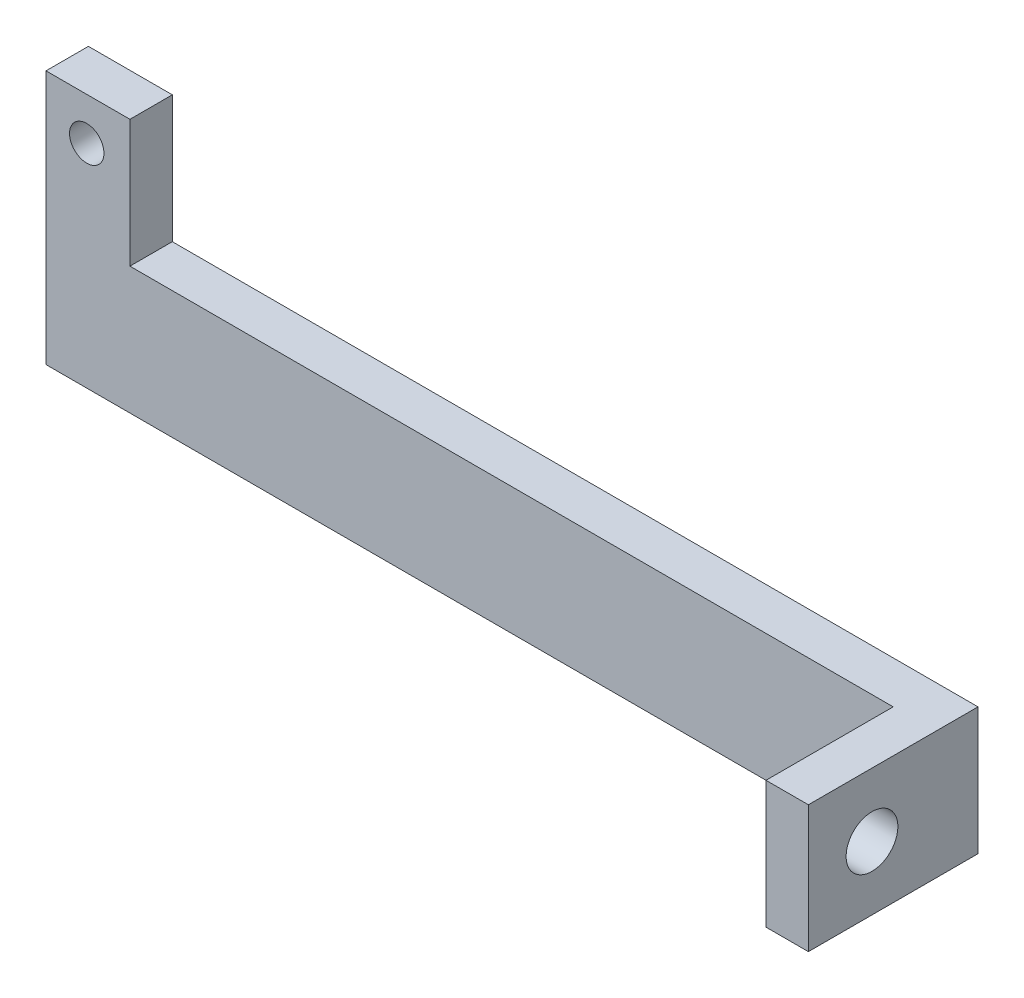
from build123d import *

# Parameters (mm, degrees)
SKETCH2_W           = 48.26
SKETCH2_H           = 7.62
BOSS_EXTRUDE1_DEPTH = 2.54
SKETCH3_W           = 5.026957718
SKETCH3_H           = 15.24
BOSS_EXTRUDE2_DEPTH = 2.54
SKETCH4_R           = 1.030507416
CUT_EXTRUDE1_DEPTH  = 2.54
SKETCH5_W           = 7.62
SKETCH5_H           = 7.62
BOSS_EXTRUDE3_DEPTH = 2.54
SKETCH6_R           = 1.55
CUT_EXTRUDE2_DEPTH  = 2.54


with BuildPart() as part:
    # Sketch2 → Boss-Extrude1 (new body)
    with BuildSketch(Plane.XY):
        with Locations((24.13, 3.81)):
            Rectangle(SKETCH2_W, SKETCH2_H)
    extrude(amount=BOSS_EXTRUDE1_DEPTH)

    # Sketch3 → Boss-Extrude2 (add)
    with BuildSketch(Plane.XY):
        with Locations((-2.513478859, 7.62)):
            Rectangle(SKETCH3_W, SKETCH3_H)
    extrude(amount=BOSS_EXTRUDE2_DEPTH)

    # Sketch4 → Cut-Extrude1 (cut)
    with BuildSketch(Plane.XY.offset(2.54)):
        with Locations((-2.586282317, 12.7)):
            Circle(SKETCH4_R)
    extrude(amount=-CUT_EXTRUDE1_DEPTH, mode=Mode.SUBTRACT)

    # Sketch5 → Boss-Extrude3 (add)
    with BuildSketch(Plane.ZY.offset(-48.26)):
        with Locations((6.35, 3.81)):
            Rectangle(SKETCH5_W, SKETCH5_H)
    extrude(amount=BOSS_EXTRUDE3_DEPTH)

    # Sketch6 → Cut-Extrude2 (cut)
    with BuildSketch(Plane.ZY.offset(-45.72)):
        with Locations((6.35, 3.81)):
            Circle(SKETCH6_R)
    extrude(amount=-CUT_EXTRUDE2_DEPTH, mode=Mode.SUBTRACT)


solid = part.part
